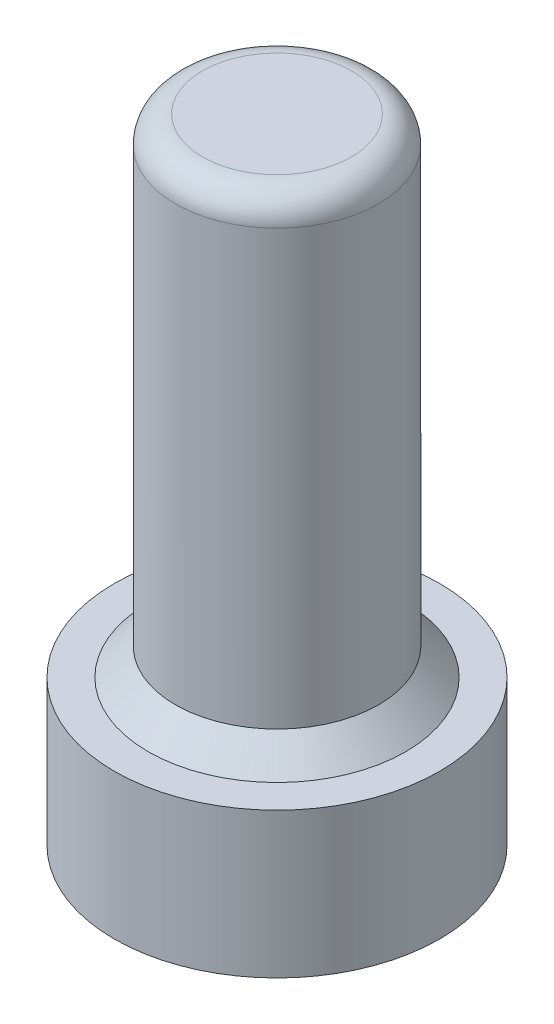
from build123d import *

# Parameters (mm, degrees)
FILLET1_R = 0.5


with BuildPart() as part:
    # Sketch1 → Revolve1 (revolve)
    with BuildSketch(Plane.XY):
        Polygon((0, 11.68), (1.875, 11.68), (1.875, 3.18), (2.375, 2.68), (3, 2.68), (3, 0), (0, 0), align=None)
    revolve(axis=Axis((0, -1000, 0), (0, 1, 0)))

    # Fillet1
    fillet1_edges = [part.edges().sort_by_distance(p)[0] for p in [
        (-1.875, 11.68, 0),
    ]]
    fillet(fillet1_edges, radius=FILLET1_R)


solid = part.part
